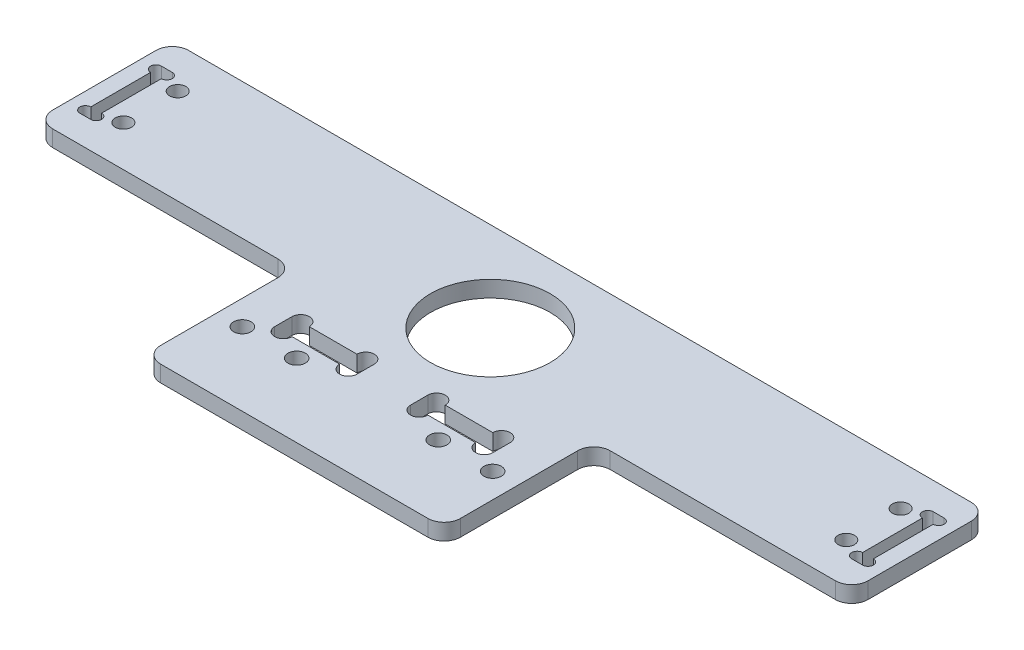
from build123d import *

# Parameters (mm, degrees)
SKETCH_1_R          = 1.6
EXTRUDE_1_DEPTH     = 3
SKETCH_5_W          = 8.427610272
SKETCH_5_H          = 29.562823711
CUT_EXTRUDE_4_DEPTH = 10
SKETCH_7_W          = 55.144779456
SKETCH_7_H          = 10
CUT_EXTRUDE_1_DEPTH = 100
CUT_EXTRUDE_5_DEPTH = 100
CUT_EXTRUDE_6_DEPTH = 100
FILLET_3_R          = 3
SKETCH_10_W         = 2
SKETCH_10_H         = 2
SKETCH_10_H_2       = 11
SKETCH_10_R         = 1.5
CUT_EXTRUDE_7_DEPTH = 10
SKETCH_11_R         = 11
CUT_EXTRUDE_8_DEPTH = 10


with BuildPart() as part:
    # 草图1 → 凸台-拉伸1 (new body)
    with BuildSketch(Plane(origin=(0, 0, 0), x_dir=(1, 0, 0), z_dir=(0, 1, 0))):
        Polygon((-1, -77.5), (-40, -77.5), (-40, -235.15), (110, -235.15), (110, -77.5), (71, -77.5), (71, -47.937176289), (113.89906921, -47.937176289), (113.89906921, 47.937176289), (71, 47.937176289), (71, 77.5), (110, 77.5), (110, 235.15), (-40, 235.15), (-40, 77.5), (-1, 77.5), (-1, 47.937176289), (-43.89906921, 47.937176289), (-43.89906921, -47.937176289), (-1, -47.937176289), align=None)
        with Locations(Location((48.025, -63.59, 0), (0, 0, 90))):
            Circle(SKETCH_1_R, mode=Mode.SUBTRACT)
        with Locations(Location((58.025, -63.59, 0), (0, 0, 90))):
            Circle(SKETCH_1_R, mode=Mode.SUBTRACT)
        with Locations(Location((58.025, 63.41, 0), (0, 0, 90))):
            Circle(SKETCH_1_R, mode=Mode.SUBTRACT)
        with Locations(Location((48.025, 63.41, 0), (0, 0, 90))):
            Circle(SKETCH_1_R, mode=Mode.SUBTRACT)
        with Locations(Location((11.975, -63.59, 0), (0, 0, 270))):
            Circle(SKETCH_1_R, mode=Mode.SUBTRACT)
        with Locations(Location((21.975, -63.59, 0), (0, 0, 270))):
            Circle(SKETCH_1_R, mode=Mode.SUBTRACT)
        with Locations(Location((21.975, 63.41, 0), (0, 0, 270))):
            Circle(SKETCH_1_R, mode=Mode.SUBTRACT)
        with Locations(Location((11.975, 63.41, 0), (0, 0, 270))):
            Circle(SKETCH_1_R, mode=Mode.SUBTRACT)
        with BuildLine():
            Line((30.075, -69.59), (30.075, -66.41))
            ThreePointArc((30.075, -66.41), (28.475, -64.81), (26.875, -66.41))
            Line((26.875, -66.41), (18.125, -66.41))
            ThreePointArc((18.125, -66.41), (16.525, -64.81), (14.925, -66.41))
            Line((14.925, -66.41), (14.925, -69.59))
            ThreePointArc((14.925, -69.59), (16.525, -71.19), (18.125, -69.59))
            Line((18.125, -69.59), (26.875, -69.59))
            ThreePointArc((26.875, -69.59), (28.475, -71.19), (30.075, -69.59))
        make_face(mode=Mode.SUBTRACT)
        with BuildLine():
            Line((43.125, 69.59), (51.875, 69.59))
            ThreePointArc((51.875, 69.59), (53.475, 71.19), (55.075, 69.59))
            Line((55.075, 69.59), (55.075, 66.41))
            ThreePointArc((55.075, 66.41), (53.475, 64.81), (51.875, 66.41))
            Line((51.875, 66.41), (43.125, 66.41))
            ThreePointArc((43.125, 66.41), (41.525, 64.81), (39.925, 66.41))
            Line((39.925, 66.41), (39.925, 69.59))
            ThreePointArc((39.925, 69.59), (41.525, 71.19), (43.125, 69.59))
        make_face(mode=Mode.SUBTRACT)
        with BuildLine():
            Line((55.075, -69.59), (55.075, -66.41))
            ThreePointArc((55.075, -66.41), (53.475, -64.81), (51.875, -66.41))
            Line((51.875, -66.41), (43.125, -66.41))
            ThreePointArc((43.125, -66.41), (41.525, -64.81), (39.925, -66.41))
            Line((39.925, -66.41), (39.925, -69.59))
            ThreePointArc((39.925, -69.59), (41.525, -71.19), (43.125, -69.59))
            Line((43.125, -69.59), (51.875, -69.59))
            ThreePointArc((51.875, -69.59), (53.475, -71.19), (55.075, -69.59))
        make_face(mode=Mode.SUBTRACT)
        with BuildLine():
            Line((14.925, 69.59), (14.925, 66.41))
            ThreePointArc((14.925, 66.41), (16.525, 64.81), (18.125, 66.41))
            Line((18.125, 66.41), (26.875, 66.41))
            ThreePointArc((26.875, 66.41), (28.475, 64.81), (30.075, 66.41))
            Line((30.075, 66.41), (30.075, 69.59))
            ThreePointArc((30.075, 69.59), (28.475, 71.19), (26.875, 69.59))
            Line((26.875, 69.59), (18.125, 69.59))
            ThreePointArc((18.125, 69.59), (16.525, 71.19), (14.925, 69.59))
        make_face(mode=Mode.SUBTRACT)
    extrude(amount=EXTRUDE_1_DEPTH)

    # 草图5 → 切除-拉伸4 (cut)
    with BuildSketch(Plane.XZ):
        with Locations((66.786194864, 62.718588145)):
            Rectangle(SKETCH_5_W, SKETCH_5_H)
        with Locations((3.213805136, 62.718588145)):
            Rectangle(SKETCH_5_W, SKETCH_5_H)
        with Locations((3.213805136, -62.718588145)):
            Rectangle(SKETCH_5_W, SKETCH_5_H)
        with Locations((66.786194864, -62.718588145)):
            Rectangle(SKETCH_5_W, SKETCH_5_H)
    extrude(amount=-CUT_EXTRUDE_4_DEPTH, mode=Mode.SUBTRACT)

    # 草图7 → 切除-拉伸-薄壁1 (cut)
    with BuildSketch(Plane(origin=(0, 0, 0), x_dir=(-1, 0, 0), z_dir=(0, -1, 0))):
        with Locations((-35, -55.277176289)):
            Rectangle(SKETCH_7_W, SKETCH_7_H)
        Polygon((-113.89906921, -0.33), (-113.89906921, 47.607176289), (-62.572389728, 47.607176289), (-62.572389728, 49.947176289), (-7.427610272, 49.947176289), (-7.427610272, 47.607176289), (43.89906921, 47.607176289), (43.89906921, -0.33), (33.89906921, -0.33), (33.89906921, 37.607176289), (-17.427610272, 37.607176289), (-17.427610272, 39.947176289), (-52.572389728, 39.947176289), (-52.572389728, 37.607176289), (-103.89906921, 37.607176289), (-103.89906921, -0.33), align=None)
    extrude(amount=-CUT_EXTRUDE_1_DEPTH, mode=Mode.SUBTRACT)


with BuildPart() as cut_extrude_1_piece_1:
    # of the separate pieces the step leaves, piece 1, a body of its own (cut_extrude_1_pieces)
    add(part.part.solids().sort_by_distance((7.427610272, 0, -77.5))[0])

    # 草图9 → 切除-拉伸6 (cut)
    with BuildSketch(Plane.XZ):
        Polygon((-40, -102.5), (110, -102.5), (124.211694431, -119.691261336), (154.987235789, -211.57345947), (124.211694431, -286.861832075), (-63.673505757, -270.701496299), (-75.556105593, -182.770257517), (-74.082044988, -165.632360403), align=None)
    extrude(amount=-CUT_EXTRUDE_6_DEPTH, mode=Mode.SUBTRACT)

    # 圆角3
    fillet_3_edges = [cut_extrude_1_piece_1.edges().sort_by_distance(p)[0] for p in [
        (110, 1.5, -77.5),
        (-40, 1.5, -77.5),
        (62.572389728, 1.5, -77.5),
        (7.427610272, 1.5, -77.5),
        (-40, 1.5, -102.5),
        (110, 1.5, -102.5),
        (7.427610272, 1.5, -49.947176289),
        (62.572389728, 1.5, -49.947176289),
    ]]
    fillet(fillet_3_edges, radius=FILLET_3_R)

    # 草图10 → 切除-拉伸7 (cut)
    with BuildSketch(Plane.XZ):
        with BuildLine():
            ThreePointArc((-35, -84.5), (-34, -83.5), (-35, -82.5))
            Line((-35, -82.5), (-35, -84.5))
        make_face()
        with BuildLine():
            Line((-37, -84.5), (-37, -82.5))
            ThreePointArc((-37, -82.5), (-38, -83.5), (-37, -84.5))
        make_face()
        with Locations((-36, -83.5)):
            Rectangle(SKETCH_10_W, SKETCH_10_H)
        with Locations((-36, -90)):
            Rectangle(SKETCH_10_W, SKETCH_10_H_2)
        with Locations((-36, -96.5)):
            Rectangle(SKETCH_10_W, SKETCH_10_H)
        with BuildLine():
            Line((-37, -97.5), (-37, -95.5))
            ThreePointArc((-37, -95.5), (-38, -96.5), (-37, -97.5))
        make_face()
        with BuildLine():
            ThreePointArc((-35, -97.5), (-34, -96.5), (-35, -95.5))
            Line((-35, -95.5), (-35, -97.5))
        make_face()
        with Locations(Location((-31.5, -95, 0), (0, 0, 270))):
            Circle(SKETCH_10_R)
        with Locations(Location((-31.5, -85, 0), (0, 0, 270))):
            Circle(SKETCH_10_R)
        with BuildLine():
            ThreePointArc((107, -97.5), (108, -96.5), (107, -95.5))
            Line((107, -95.5), (107, -97.5))
        make_face()
        with Locations((106, -96.5)):
            Rectangle(SKETCH_10_W, SKETCH_10_H)
        with BuildLine():
            Line((105, -97.5), (105, -95.5))
            ThreePointArc((105, -95.5), (104, -96.5), (105, -97.5))
        make_face()
        with Locations((106, -90)):
            Rectangle(SKETCH_10_W, SKETCH_10_H_2)
        with BuildLine():
            ThreePointArc((107, -84.5), (108, -83.5), (107, -82.5))
            Line((107, -82.5), (107, -84.5))
        make_face()
        with Locations((106, -83.5)):
            Rectangle(SKETCH_10_W, SKETCH_10_H)
        with BuildLine():
            Line((105, -84.5), (105, -82.5))
            ThreePointArc((105, -82.5), (104, -83.5), (105, -84.5))
        make_face()
        with Locations(Location((101.5, -85, 0), (0, 0, 270))):
            Circle(SKETCH_10_R)
        with Locations(Location((101.5, -95, 0), (0, 0, 270))):
            Circle(SKETCH_10_R)
    extrude(amount=-CUT_EXTRUDE_7_DEPTH, mode=Mode.SUBTRACT)

    # 草图11 → 切除-拉伸8 (cut)
    with BuildSketch(Plane.XZ):
        with Locations(Location((35, -86.015496457, 0), (0, 0, 270))):
            Circle(SKETCH_11_R)
    extrude(amount=-CUT_EXTRUDE_8_DEPTH, mode=Mode.SUBTRACT)


with BuildPart() as cut_extrude_1_piece_2:
    # of the separate pieces the step leaves, piece 2, a body of its own (cut_extrude_1_pieces)
    add(part.part.solids().sort_by_distance((-40, 0, 77.5))[0])


with BuildPart() as cut_extrude_1_piece_3:
    # of the separate pieces the step leaves, piece 3, a body of its own (cut_extrude_1_pieces)
    add(part.part.solids().sort_by_distance((7.427610272, 0, 50.277176289))[0])


with BuildPart() as cut_extrude_1_piece_4:
    # of the separate pieces the step leaves, piece 4, a body of its own (cut_extrude_1_pieces)
    add(part.part.solids().sort_by_distance((113.89906921, 0, -47.607176289))[0])


with BuildPart() as cut_extrude_1_piece_5:
    # of the separate pieces the step leaves, piece 5, a body of its own (cut_extrude_1_pieces)
    add(part.part.solids().sort_by_distance((-43.89906921, 0, -47.937176289))[0])


with BuildPart() as cut_extrude_5_tool:
    # 草图8 → 切除-拉伸5 (new body)
    with BuildSketch(Plane(origin=(0, 0, 0), x_dir=(-1, 0, 0), z_dir=(0, -1, 0))):
        Polygon((78.212914253, 60.385355647), (0, 54.326624312), (-4.481912928, 51.672567956), (-7.938908088, 48.761414138), (-49.331876445, 46.578048774), (-63.52375131, 48.761414138), (-79.080229528, 55.85735157), (-126.563695568, 60.385355647), (-136.561762242, 25.020008622), (-185.509289936, -177.467896247), (-114.798778659, -331.741539621), (230.896230576, -266.427705394), (230.896230576, -108.933419225), (223.681342993, -70.746247105), align=None)
    extrude(amount=-CUT_EXTRUDE_5_DEPTH)


with BuildPart() as cut_extrude_1_piece_2_1:
    add(cut_extrude_1_piece_2.part)

    # 切除-拉伸5: cut by cut_extrude_5_tool
    add(cut_extrude_5_tool.part, mode=Mode.SUBTRACT)


with BuildPart() as cut_extrude_1_piece_3_1:
    add(cut_extrude_1_piece_3.part)

    # 切除-拉伸5: cut by cut_extrude_5_tool
    add(cut_extrude_5_tool.part, mode=Mode.SUBTRACT)


with BuildPart() as cut_extrude_1_piece_4_1:
    add(cut_extrude_1_piece_4.part)

    # 切除-拉伸5: cut by cut_extrude_5_tool
    add(cut_extrude_5_tool.part, mode=Mode.SUBTRACT)


with BuildPart() as cut_extrude_1_piece_5_1:
    add(cut_extrude_1_piece_5.part)

    # 切除-拉伸5: cut by cut_extrude_5_tool
    add(cut_extrude_5_tool.part, mode=Mode.SUBTRACT)


solid = cut_extrude_1_piece_1.part
